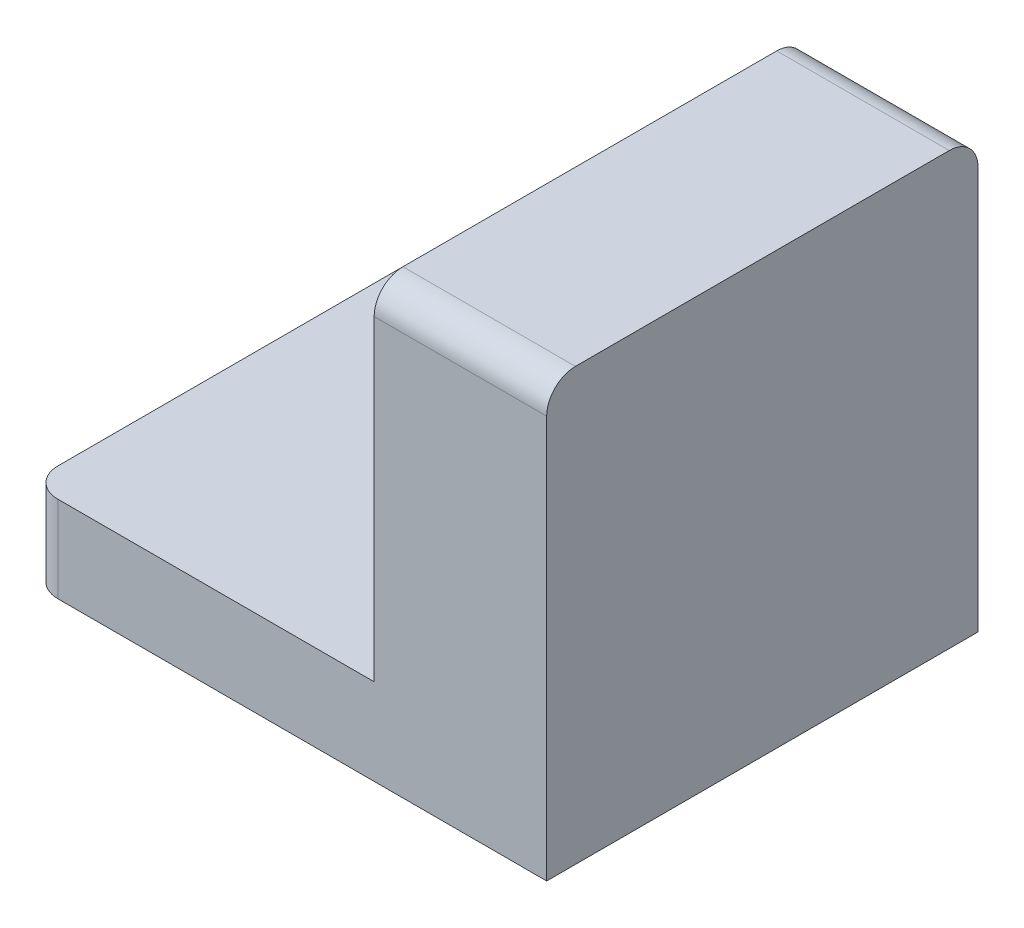
from build123d import *

# Parameters (mm, degrees)
SKETCH_1_W          = 18
SKETCH_1_H          = 15
EXTRUDE_1_DEPTH     = 15
SKETCH_2_W          = 12
SKETCH_2_H          = 15
CUT_EXTRUDE_1_DEPTH = 12
FILLET_1_R          = 1
SKETCH_3_R          = 5.125
CUT_EXTRUDE_2_DEPTH = 5.5
SKETCH_4_R          = 2.125
CUT_EXTRUDE_3_DEPTH = 5.5


with BuildPart() as part:
    # 草圖1 → 填料-伸長1 (new body)
    with BuildSketch(Plane(origin=(0, 0, 0), x_dir=(1, 0, 0), z_dir=(0, 1, 0))):
        with Locations((1, 0)):
            Rectangle(SKETCH_1_W, SKETCH_1_H)
    extrude(amount=EXTRUDE_1_DEPTH)

    # 草圖2 → 除料-伸長1 (cut)
    with BuildSketch(Plane(origin=(0, 15, 0), x_dir=(1, 0, 0), z_dir=(0, 1, 0))):
        with Locations((-2, 0)):
            Rectangle(SKETCH_2_W, SKETCH_2_H)
    extrude(amount=-CUT_EXTRUDE_1_DEPTH, mode=Mode.SUBTRACT)

    # 圓角1
    fillet_1_edges = [part.edges().sort_by_distance(p)[0] for p in [
        (7, 15, 7.5),
        (-8, 1.5, -7.5),
        (-8, 1.5, 7.5),
        (7, 15, -7.5),
    ]]
    fillet(fillet_1_edges, radius=FILLET_1_R)

    # 草圖3 → 除料-伸長2 (cut)
    with BuildSketch(Plane.ZY.offset(-4)):
        with Locations((0, 9)):
            Circle(SKETCH_3_R)
    extrude(amount=-CUT_EXTRUDE_2_DEPTH, mode=Mode.SUBTRACT)

    # 草圖4 → 除料-伸長3 (cut)
    with BuildSketch(Plane(origin=(0, 3, 0), x_dir=(1, 0, 0), z_dir=(0, 1, 0))):
        with Locations(Location((0, 0, 0), (0, 0, 270))):
            Circle(SKETCH_4_R)
    extrude(amount=-CUT_EXTRUDE_3_DEPTH, mode=Mode.SUBTRACT)


solid = part.part
